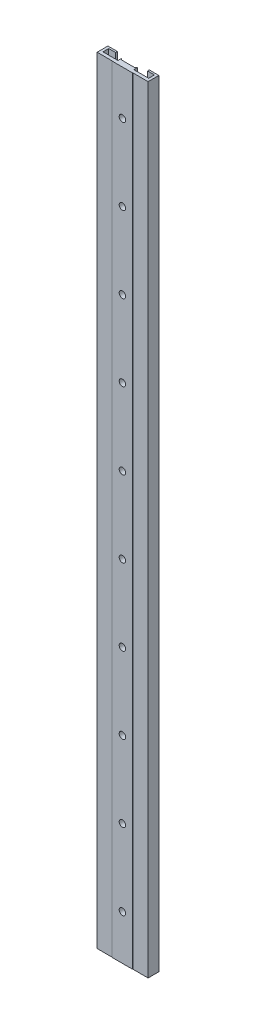
from build123d import *

# Parameters (mm, degrees)
BOSS_EXTRUDE1_DEPTH = 609.6
SKETCH2_R           = 2.54
CUT_EXTRUDE1_DEPTH  = 508


with BuildPart() as part:
    # Sketch1 → Boss-Extrude1 (new body)
    with BuildSketch(Plane(origin=(0, 0, 0), x_dir=(1, 0, 0), z_dir=(0, 1, 0))):
        Polygon((0, 8.4582), (0, 0), (11.9761, 0), (11.9761, -0.1524), (28.0289, -0.1524), (28.0289, 0), (40.005, 0), (40.005, 8.4582), (32.512, 8.4582), (32.512, 7.0612), (37.973, 7.0612), (37.973, 2.54), (26.2509, 2.54), (26.2509, 5.269994695), (25.298905305, 4.318), (14.706094695, 4.318), (13.7541, 5.269994695), (13.7541, 2.54), (2.032, 2.54), (2.032, 7.0612), (7.493, 7.0612), (7.493, 8.4582), align=None)
    extrude(amount=BOSS_EXTRUDE1_DEPTH)

    # Sketch2 → Cut-Extrude1 (cut)
    with BuildSketch(Plane(origin=(0, 0, -4.318), x_dir=(-1, 0, 0), z_dir=(0, 0, -1))):
        with Locations((-20.0025, 574.675)):
            Circle(SKETCH2_R)
        with Locations((-20.0025, 514.731)):
            Circle(SKETCH2_R)
        with Locations((-20.0025, 454.787)):
            Circle(SKETCH2_R)
        with Locations((-20.0025, 394.843)):
            Circle(SKETCH2_R)
        with Locations((-20.0025, 334.899)):
            Circle(SKETCH2_R)
        with Locations((-20.0025, 274.955)):
            Circle(SKETCH2_R)
        with Locations((-20.0025, 215.011)):
            Circle(SKETCH2_R)
        with Locations((-20.0025, 155.067)):
            Circle(SKETCH2_R)
        with Locations((-20.0025, 95.123)):
            Circle(SKETCH2_R)
        with Locations((-20.0025, 35.179)):
            Circle(SKETCH2_R)
    extrude(amount=-CUT_EXTRUDE1_DEPTH, mode=Mode.SUBTRACT)


solid = part.part
